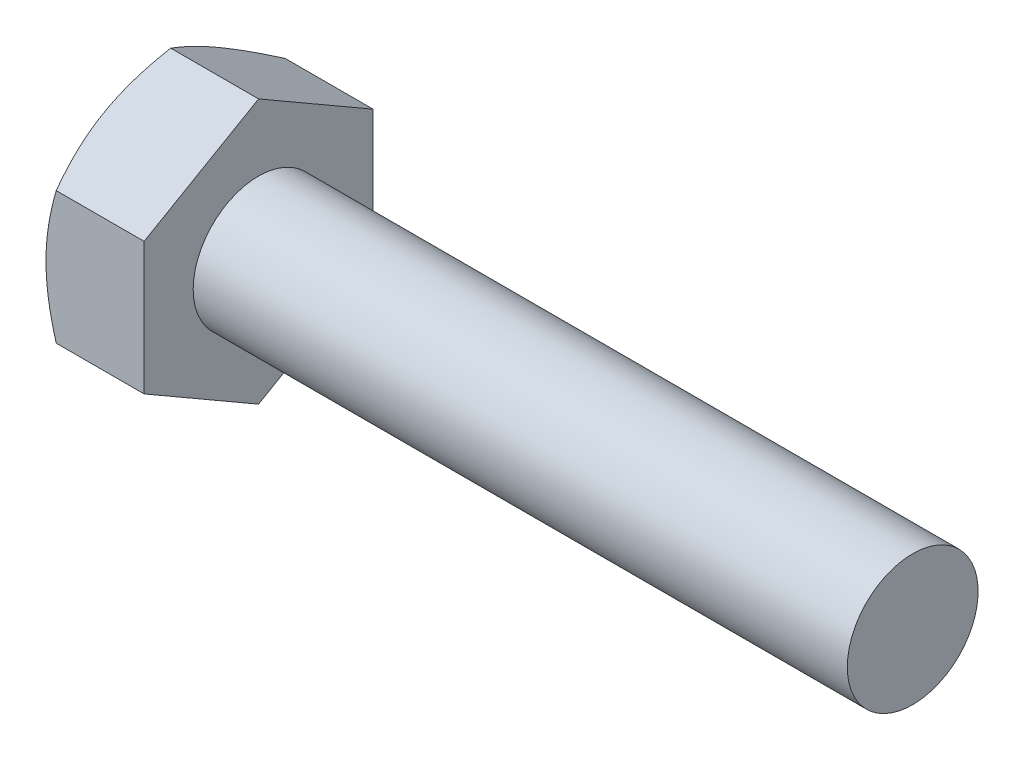
from build123d import *

# Parameters (mm, degrees)
SKETCH2_R     = 4.081986143
HEX_DIE_DEPTH = 3
SKETCH4_R     = 3.0625
INDENT_DEPTH  = 0.375


with BuildPart() as part:
    # BodySke → Base-Revolve (revolve)
    with BuildSketch(Plane.XY, mode=Mode.PRIVATE) as base_revolve_sk:
        Polygon((3, 2), (3, 4.041570439), (0.312675839, 4.041570439), (0, 3.5), (0, 0), (23, 0), (23, 2), align=None)
    revolve(base_revolve_sk.sketch.rotate(Axis((-25.4, 0, 0), (1, 0, 0)), 90), axis=Axis((-25.4, 0, 0), (1, 0, 0)))

    # Sketch2 → Hex-Die (cut)
    with BuildSketch(Plane(origin=(0, 0, 0), x_dir=(0, 0, -1), z_dir=(1, 0, 0))):
        Circle(SKETCH2_R)
        Polygon((-3.5, 2.020725951), (0, 4.041451902), (3.5, 2.020725951), (3.5, -2.020725951), (0, -4.041451902), (-3.5, -2.020725951), align=None, mode=Mode.SUBTRACT)
    extrude(amount=HEX_DIE_DEPTH, mode=Mode.SUBTRACT)

    # Sketch4 → Indent (cut)
    with BuildSketch(Plane(origin=(0, 0, 0), x_dir=(0, 0, -1), z_dir=(1, 0, 0))):
        Circle(SKETCH4_R)
    extrude(amount=INDENT_DEPTH, mode=Mode.SUBTRACT)


solid = part.part
